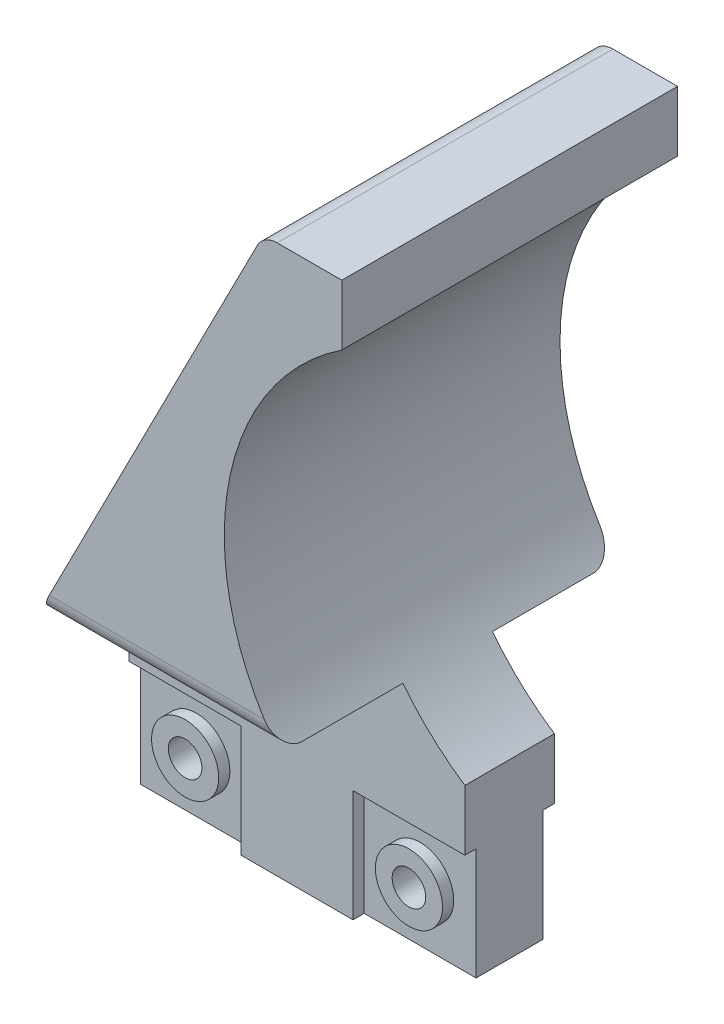
from build123d import *

# Parameters (mm, degrees)
SKETCH_1_R           = 1.5
EXTRUDE_1_DEPTH      = 8
EXTRUDE_2_DEPTH      = 19
EXTRUDE_2_DEPTH_BACK = 11
FILLET_1_R           = 2
FILLET_2_R           = 2
FILLET_4_R           = 2
FILLET_5_R           = 2
SKETCH_3_W           = 10
SKETCH_3_H           = 10
SKETCH_3_R           = 3
CUT_EXTRUDE_1_DEPTH  = 8
SKETCH_3_2_W         = 10
SKETCH_3_2_H         = 10
SKETCH_3_2_R         = 3
EXTRUDE_3_DEPTH      = 7
SKETCH_3_3_W         = 10
SKETCH_3_3_H         = 10
SKETCH_3_3_R         = 3
CUT_EXTRUDE_2_DEPTH  = 1


with BuildPart() as part:
    # 草图1 → 凸台-拉伸1 (new body)
    with BuildSketch(Plane.XY):
        with BuildLine():
            Line((-15, 0), (15, 0))
            Line((15, 0), (15, 15.404082058))
            ThreePointArc((15, 15.404082058), (4.5, 35), (15, 54.595917942))
            Line((15, 54.595917942), (15, 60))
            Line((15, 60), (8, 60))
            Line((8, 60), (-15, 15))
            Line((-15, 15), (-15, 0))
        make_face()
        with Locations((-10, 5)):
            Circle(SKETCH_1_R, mode=Mode.SUBTRACT)
        with Locations((10, 5)):
            Circle(SKETCH_1_R, mode=Mode.SUBTRACT)
    extrude(amount=EXTRUDE_1_DEPTH)

    # 草图2 → 凸台-拉伸2 (add, two sides: drawn at the far end of the back side and taken through both)
    with BuildSketch(Plane.XY.offset(-EXTRUDE_2_DEPTH_BACK)):
        with BuildLine():
            Line((-12.166399205, 20.544001556), (8, 60))
            Line((8, 60), (15, 60))
            Line((15, 60), (15, 54.595917942))
            ThreePointArc((15, 54.595917942), (4.805132127, 38.777552052), (9.462778171, 20.544001556))
            Line((9.462778171, 20.544001556), (-12.166399205, 20.544001556))
        make_face()
    extrude(amount=EXTRUDE_2_DEPTH + EXTRUDE_2_DEPTH_BACK)

    # 圆角1
    fillet_1_edges = [part.edges().sort_by_distance(p)[0] for p in [
        (-1.351810517, 20.544001556, 19),
    ]]
    fillet(fillet_1_edges, radius=FILLET_1_R)

    # 圆角2
    fillet_2_edges = [part.edges().sort_by_distance(p)[0] for p in [
        (-1.351810517, 20.544001556, -11),
    ]]
    fillet(fillet_2_edges, radius=FILLET_2_R)

    # 圆角4
    fillet_4_edges = [part.edges().sort_by_distance(p)[0] for p in [
        (8, 60, 4),
    ]]
    fillet(fillet_4_edges, radius=FILLET_4_R)

    # 圆角5
    fillet_5_edges = [part.edges().sort_by_distance(p)[0] for p in [
        (15, 0, 4),
        (-15, 0, 4),
    ]]
    fillet(fillet_5_edges, radius=FILLET_5_R)

    # 草图3 → 切除-拉伸1 (cut)
    # profile 1 of 2: a face of its own
    with BuildSketch(Plane(origin=(0, 0, 0), x_dir=(-1, 0, 0), z_dir=(0, 0, -1))):
        with Locations((-10, 5)):
            Rectangle(SKETCH_3_W, SKETCH_3_H)
        with Locations((-10, 5)):
            Circle(SKETCH_3_R, mode=Mode.SUBTRACT)
    # profile 2 of 2: a face of its own
    with BuildSketch(Plane(origin=(0, 0, 0), x_dir=(-1, 0, 0), z_dir=(0, 0, -1))):
        with Locations((10, 5)):
            Rectangle(SKETCH_3_W, SKETCH_3_H)
        with Locations((10, 5)):
            Circle(SKETCH_3_R, mode=Mode.SUBTRACT)
    extrude(amount=-CUT_EXTRUDE_1_DEPTH, mode=Mode.SUBTRACT)


with BuildPart() as cut_extrude_1_piece_1:
    # of the separate pieces the step leaves, piece 1, a body of its own (cut_extrude_1_pieces)
    add(part.part.solids().sort_by_distance((-12.166399205, 20.544001556, 0))[0])



with BuildPart() as cut_extrude_1_piece_2:
    # of the separate pieces the step leaves, piece 2, a body of its own (cut_extrude_1_pieces)
    add(part.part.solids().sort_by_distance((-13, 5, 0))[0])


with BuildPart() as cut_extrude_1_piece_3:
    # of the separate pieces the step leaves, piece 3, a body of its own (cut_extrude_1_pieces)
    add(part.part.solids().sort_by_distance((7, 5, 0))[0])


with BuildPart() as cut_extrude_1_piece_1_1:
    add(cut_extrude_1_piece_1.part)

    add(cut_extrude_1_piece_2.part)  # 凸台-拉伸3 merges 切除-拉伸1 piece 2

    add(cut_extrude_1_piece_3.part)  # 凸台-拉伸3 merges 切除-拉伸1 piece 3
    # 草图3<2> → 凸台-拉伸3 (add)
    # profile 1 of 2: a face of its own
    with BuildSketch(Plane(origin=(0, 0, 0), x_dir=(-1, 0, 0), z_dir=(0, 0, -1))):
        with Locations((-10, 5)):
            Rectangle(SKETCH_3_2_W, SKETCH_3_2_H)
        with Locations((-10, 5)):
            Circle(SKETCH_3_2_R, mode=Mode.SUBTRACT)
    # profile 2 of 2: a face of its own
    with BuildSketch(Plane(origin=(0, 0, 0), x_dir=(-1, 0, 0), z_dir=(0, 0, -1))):
        with Locations((10, 5)):
            Rectangle(SKETCH_3_2_W, SKETCH_3_2_H)
        with Locations((10, 5)):
            Circle(SKETCH_3_2_R, mode=Mode.SUBTRACT)
    extrude(amount=-EXTRUDE_3_DEPTH)

    # 草图3<3> → 切除-拉伸2 (cut)
    # profile 1 of 2: a face of its own
    with BuildSketch(Plane(origin=(0, 0, 0), x_dir=(-1, 0, 0), z_dir=(0, 0, -1))):
        with Locations((-10, 5)):
            Rectangle(SKETCH_3_3_W, SKETCH_3_3_H)
        with Locations((-10, 5)):
            Circle(SKETCH_3_3_R, mode=Mode.SUBTRACT)
    # profile 2 of 2: a face of its own
    with BuildSketch(Plane(origin=(0, 0, 0), x_dir=(-1, 0, 0), z_dir=(0, 0, -1))):
        with Locations((10, 5)):
            Rectangle(SKETCH_3_3_W, SKETCH_3_3_H)
        with Locations((10, 5)):
            Circle(SKETCH_3_3_R, mode=Mode.SUBTRACT)
    extrude(amount=-CUT_EXTRUDE_2_DEPTH, mode=Mode.SUBTRACT)


solid = cut_extrude_1_piece_1_1.part
